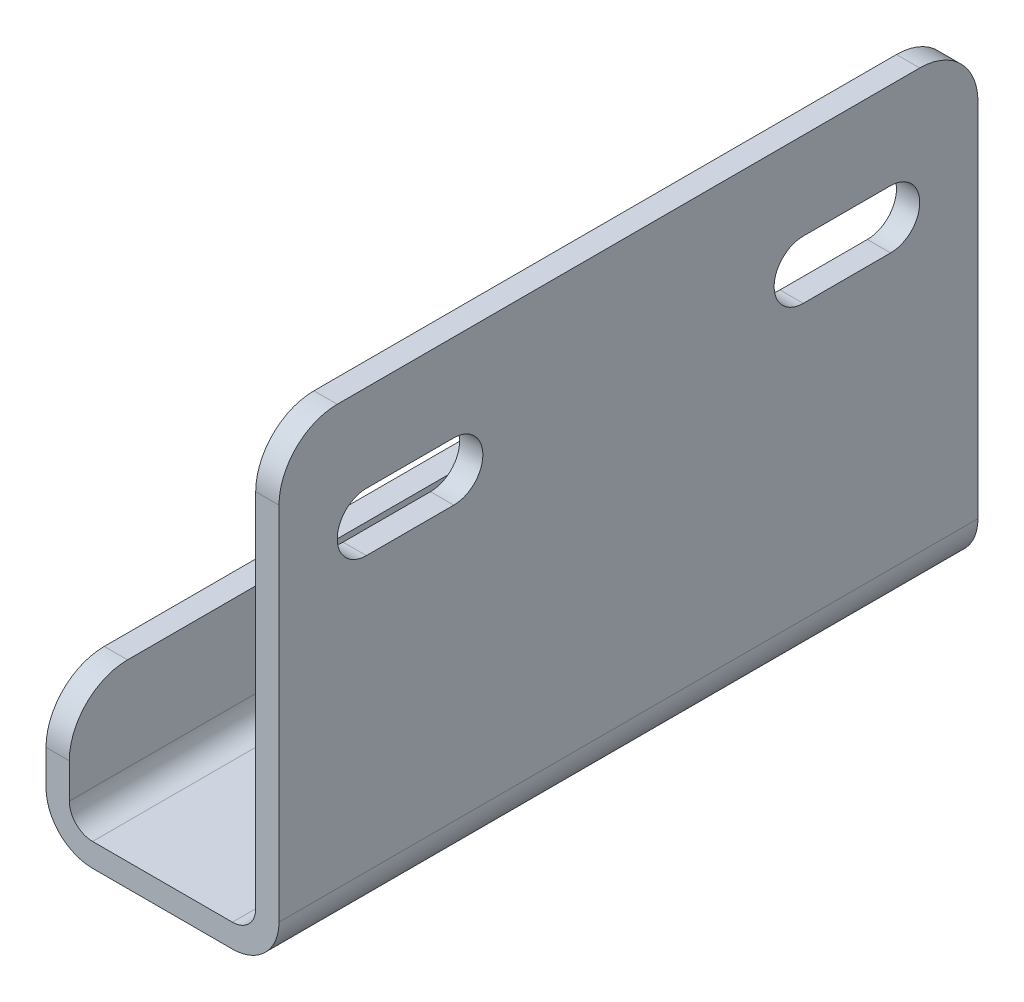
from build123d import *

# Parameters (mm, degrees)
BOSS_EXTRUDE1_DEPTH      = 38.1
CUT_EXTRUDE1_DEPTH       = 66.598911576
CUT_EXTRUDE1_DEPTH_BACK  = 66.598911576
FILLET1_R                = 6.35
FILLET2_R                = 2.54
FILLET3_R                = 5.08
SCHIZZO1_R               = 1.5
TAGLIO_ESTRUSIONE1_DEPTH = 10


with BuildPart() as part:
    # Sketch1 → Boss-Extrude1 (new, symmetric)
    with BuildSketch(Plane.XY):
        Polygon((0, 0), (0, 48.26), (2.54, 48.26), (2.54, -2.54), (-22.86, -2.54), (-22.86, 0), (-22.86, 12.7), (-20.32, 12.7), (-20.32, 0), align=None)
    extrude(amount=BOSS_EXTRUDE1_DEPTH, both=True)

    # Sketch2 → Cut-Extrude1 (cut, two sides: drawn at the far end of the back side and taken through both)
    with BuildSketch(Plane.ZY.offset(-CUT_EXTRUDE1_DEPTH_BACK)):
        with BuildLine():
            Line((-28.575, 38.735), (-19.05, 38.735))
            ThreePointArc((-19.05, 38.735), (-15.875, 35.56), (-19.05, 32.385))
            Line((-19.05, 32.385), (-28.575, 32.385))
            ThreePointArc((-28.575, 32.385), (-31.75, 35.56), (-28.575, 38.735))
        make_face()
        with BuildLine():
            Line((19.05, 38.735), (28.575, 38.735))
            ThreePointArc((28.575, 38.735), (31.75, 35.56), (28.575, 32.385))
            Line((28.575, 32.385), (19.05, 32.385))
            ThreePointArc((19.05, 32.385), (15.875, 35.56), (19.05, 38.735))
        make_face()
    extrude(amount=CUT_EXTRUDE1_DEPTH + CUT_EXTRUDE1_DEPTH_BACK, mode=Mode.SUBTRACT)

    # Fillet1
    fillet1_edges = [part.edges().sort_by_distance(p)[0] for p in [
        (-21.59, 12.7, 38.1),
        (-21.59, 12.7, -38.1),
        (1.27, 48.26, 38.1),
        (1.27, 48.26, -38.1),
    ]]
    fillet(fillet1_edges, radius=FILLET1_R)

    # Fillet2
    fillet2_edges = [part.edges().sort_by_distance(p)[0] for p in [
        (0, 0, 0),
        (-20.32, 0, 0),
    ]]
    fillet(fillet2_edges, radius=FILLET2_R)

    # Fillet3
    fillet3_edges = [part.edges().sort_by_distance(p)[0] for p in [
        (2.54, -2.54, 0),
        (-22.86, -2.54, 0),
    ]]
    fillet(fillet3_edges, radius=FILLET3_R)

    # Schizzo1 → Taglio-Estrusione1 (cut)
    with BuildSketch(Plane(origin=(0, 0, 0), x_dir=(1, 0, 0), z_dir=(0, 1, 0))):
        with Locations(Location((-10.16, 25, 0), (0, 0, 270))):
            Circle(SCHIZZO1_R)
        with Locations(Location((-10.16, -25, 0), (0, 0, 180))):
            Circle(SCHIZZO1_R)
    extrude(amount=-TAGLIO_ESTRUSIONE1_DEPTH, mode=Mode.SUBTRACT)


solid = part.part
